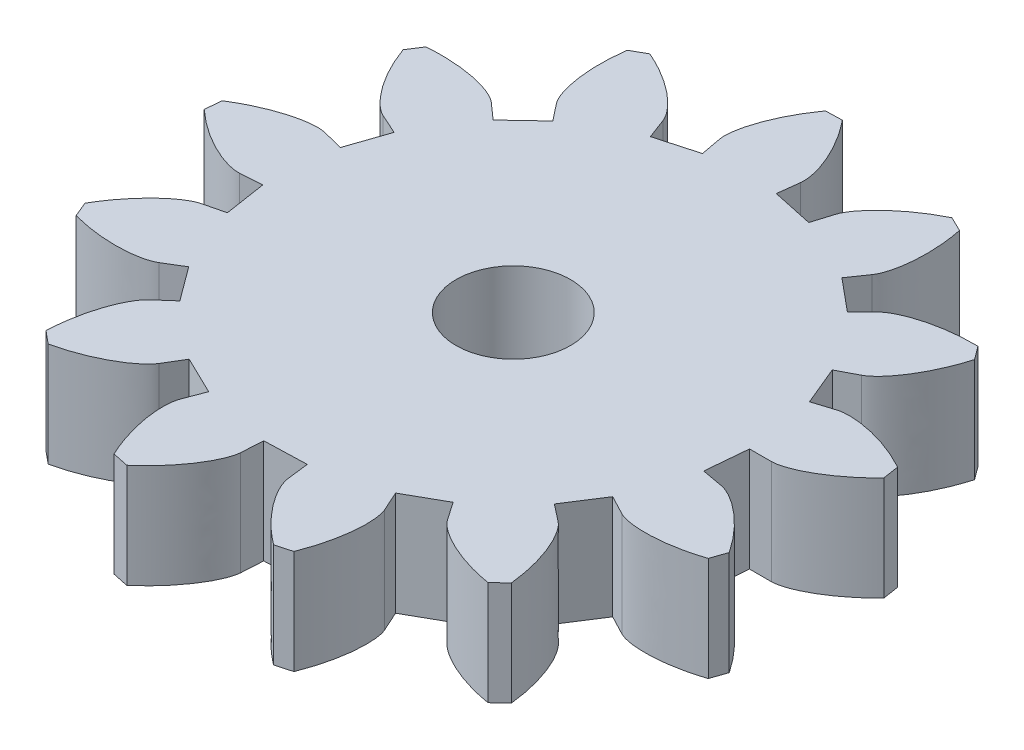
from build123d import *

# Parameters (mm, degrees)
BOSS_EXTRUDE1_DEPTH = 1.5
CIRPATTERN1_COUNT   = 13
SKETCH3_R           = 1.65
CUT_EXTRUDE1_DEPTH  = 14.816151508


with BuildPart() as part:
    # Sketch4 → Boss-Extrude1 (new, symmetric)
    with BuildSketch(Plane(origin=(0, 0, 0), x_dir=(1, 0, 0), z_dir=(0, 1, 0))):
        with BuildLine():
            Line((0, 0), (6.263275645, 2.602750232))
            Line((6.263275645, 2.602750232), (6.496786874, 2.040833527))
            Line((6.496786874, 2.040833527), (7.095523768, 2.228900768))
            add(Edge.make_bspline(
                [(7.095523768, 2.228900768), (7.470588939, 2.346711234), (8.409453089, 2.221187502), (9.397063968, 1.682132101)],
                knots=[0, 0, 0, 0, 1, 1, 1, 1], degree=3))
            Line((9.397063968, 1.682132101), (9.433162207, 1.44676802))
            Line((9.433162207, 1.44676802), (9.469259758, 1.211403835))
            add(Edge.make_bspline(
                [(7.437368902, 1.5039e-05), (7.830501435, 2.3376e-05), (8.688593456, 0.401147025), (9.469259758, 1.211403835)],
                knots=[0, 0, 0, 0, 1, 1, 1, 1], degree=3))
            Line((7.437368902, 1.5039e-05), (6.809790098, 1.731e-06))
            Line((6.809790098, 1.731e-06), (6.755413504, -0.606068449))
            Line((6.755413504, -0.606068449), (0, 0))
        make_face()
    boss_extrude1 = extrude(amount=BOSS_EXTRUDE1_DEPTH, both=True)

    # CirPattern1: Boss-Extrude1 ×13 about axis
    cirpattern1_axis = Axis((0, -1.5, 0), (0, 1, 0))
    for i in range(1, CIRPATTERN1_COUNT):
        add(boss_extrude1.rotate(cirpattern1_axis, i * 360 / CIRPATTERN1_COUNT))

    # Sketch3 → Cut-Extrude1 (cut, through all)
    with BuildSketch(Plane(origin=(0, 1.5, 0), x_dir=(1, 0, 0), z_dir=(0, 1, 0))):
        Circle(SKETCH3_R)
    extrude(amount=-CUT_EXTRUDE1_DEPTH, mode=Mode.SUBTRACT)


solid = part.part
